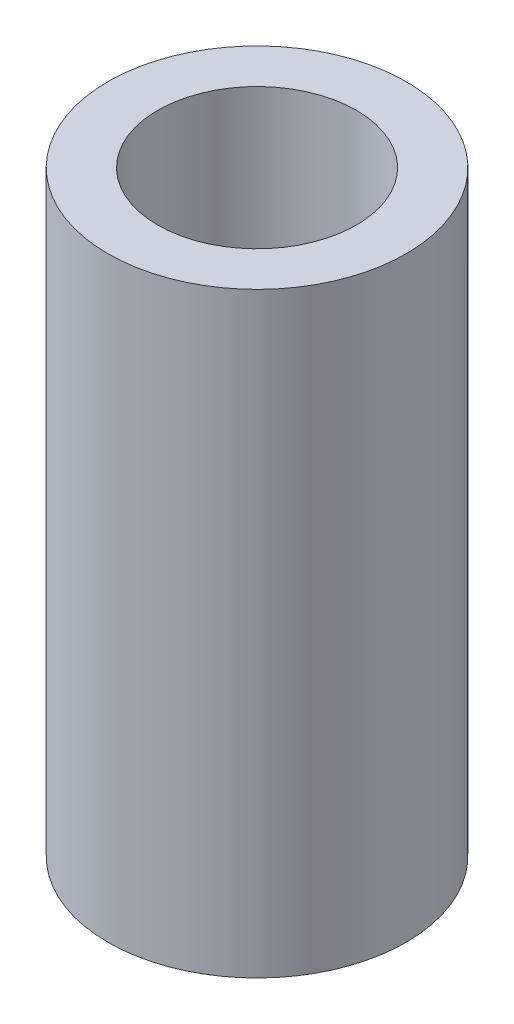
from build123d import *

# Parameters (mm, degrees)
SKETCH1_R           = 2.25
SKETCH1_R_2         = 1.5
BOSS_EXTRUDE1_DEPTH = 9


with BuildPart() as part:
    # Sketch1 → Boss-Extrude1 (new body)
    with BuildSketch(Plane(origin=(0, 0, 0), x_dir=(1, 0, 0), z_dir=(0, 1, 0))):
        with Locations(Location((0, 0, 0), (0, 0, 270))):
            Circle(SKETCH1_R)
        with Locations(Location((0, 0, 0), (0, 0, 270))):
            Circle(SKETCH1_R_2, mode=Mode.SUBTRACT)
    extrude(amount=BOSS_EXTRUDE1_DEPTH)


solid = part.part
